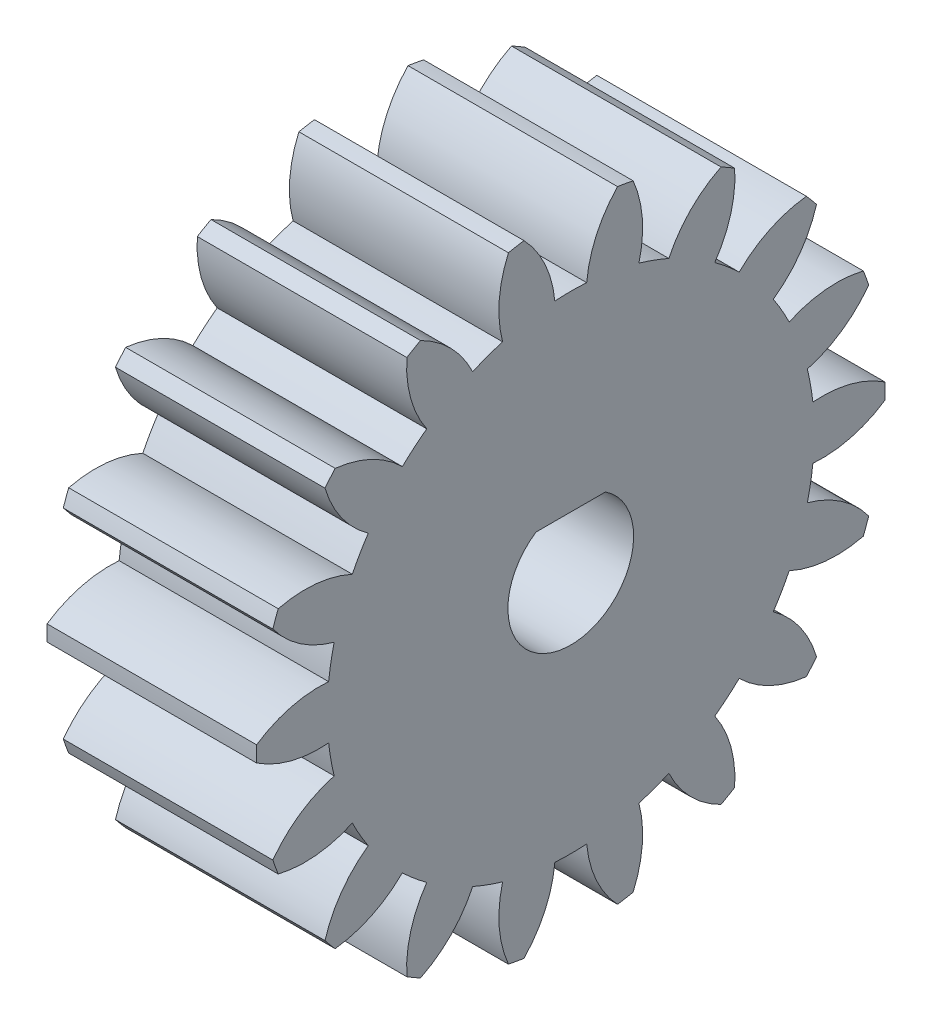
from build123d import *

# Parameters (mm, degrees)
BASPROSKE_W         = 10
BASPROSKE_H         = 15
TOOTHCUT_DEPTH      = 24.452078799
TEETHCUTS_COUNT     = 18
TEETHCUTS_ANGLE     = 340
BORSKE_R            = 3
BORE_DEPTH          = 50.0000508
BOSS_EXTRUDE1_DEPTH = 10


with BuildPart() as part:
    # BasProSke → Base-Revolve (revolve)
    with BuildSketch(Plane(origin=(0, 0, 0), x_dir=(1, 0, 0), z_dir=(0, 1, 0)), mode=Mode.PRIVATE) as base_revolve_sk:
        with Locations((5, 7.5)):
            Rectangle(BASPROSKE_W, BASPROSKE_H)
    revolve(base_revolve_sk.sketch.rotate(Axis((-10, 0, 0), (1, 0, 0)), 180), axis=Axis((-10, 0, 0), (1, 0, 0)))

    # TooCutSke → ToothCut (cut, through all)
    with BuildSketch(Plane(origin=(0, 0, 0), x_dir=(0, 0, -1), z_dir=(1, 0, 0))):
        with BuildLine():
            ThreePointArc((0.759974923, 11.599129886), (0, 11.624), (-0.759974923, 11.599129886))
            ThreePointArc((-0.759974923, 11.599129886), (-1.229186471, 13.354767823), (-2.254227748, 14.855339189))
            ThreePointArc((-2.254227748, 14.855339189), (0, 15.0254), (2.254227748, 14.855339189))
            ThreePointArc((2.254227748, 14.855339189), (1.229186471, 13.354767823), (0.759974923, 11.599129886))
        make_face()
    toothcut = extrude(amount=TOOTHCUT_DEPTH, mode=Mode.SUBTRACT)

    # TeethCuts: ToothCut ×18 about axis
    teethcuts_axis = Axis((-10, 0, 0), (1, 0, 0))
    for i in range(1, TEETHCUTS_COUNT):
        add(toothcut.rotate(teethcuts_axis, i * TEETHCUTS_ANGLE / (TEETHCUTS_COUNT - 1)), mode=Mode.SUBTRACT)

    # BorSke → Bore (cut, symmetric)
    with BuildSketch(Plane(origin=(0, 0, 0), x_dir=(0, 0, -1), z_dir=(1, 0, 0))):
        with Locations(Location((0, 0, 0), (0, 0, 180))):
            Circle(BORSKE_R)
    extrude(amount=BORE_DEPTH, both=True, mode=Mode.SUBTRACT)

    # Sketch1 → Boss-Extrude1 (add)
    with BuildSketch(Plane(origin=(10, 0, 0), x_dir=(0, 0, -1), z_dir=(1, 0, 0))):
        with BuildLine():
            ThreePointArc((1.658312395, 2.5), (0, 3), (-1.658312395, 2.5))
            Line((-1.658312395, 2.5), (1.658312395, 2.5))
        make_face()
    extrude(amount=-BOSS_EXTRUDE1_DEPTH)


solid = part.part
